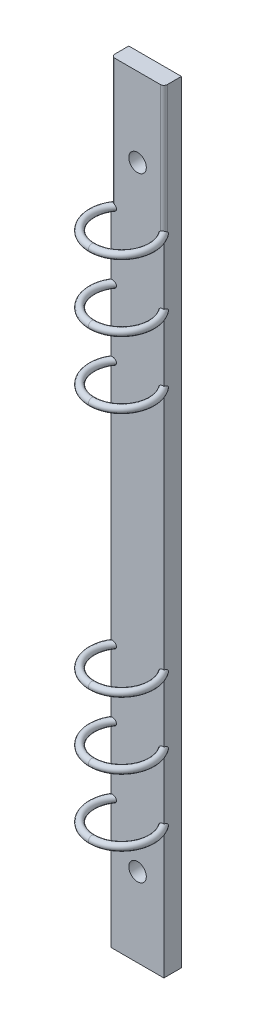
from build123d import *

# Parameters (mm, degrees)
SKETCH_1_W               = 15
SKETCH_1_H               = 220
SKETCH_1_R               = 2.5
EXTRUDE_1_DEPTH          = 5
SWEEP_2_PROFILE_R        = 1
PATTERN_LINEAR_4_COUNT   = 3
PATTERN_LINEAR_4_PITCH   = 19
MIRROR_1_COPY_1_SKETCH_R = 1
MIRROR_1_COPY_2_SKETCH_R = 1
FILLET_1_R               = 1


with BuildPart() as part:
    # Эскиз1 → Бобышка-Вытянуть1 (new body)
    with BuildSketch(Plane.XY):
        Rectangle(SKETCH_1_W, SKETCH_1_H)
        with Locations((0, 87.5)):
            Circle(SKETCH_1_R, mode=Mode.SUBTRACT)
        with Locations(Location((0, -87.5, 0), (0, 0, 180))):
            Circle(SKETCH_1_R, mode=Mode.SUBTRACT)
    extrude(amount=EXTRUDE_1_DEPTH)

    # По траектории2: sweep along a path in Эскиз28
    with BuildLine(Plane(origin=(0, 35, 0), x_dir=(1, 0, 0), z_dir=(0, 1, 0))) as sweep_2_path:
        CenterArc((0, -9.5), 8.5, 0, 360)
    # По траектории2 profile (on start of the path) → По траектории2 (sweep)
    with BuildSketch(Plane(origin=(8.5, 35, 9.5), x_dir=(-1, 0, 0), z_dir=(0, 0, -1))):
        Circle(SWEEP_2_PROFILE_R)
    sweep_2 = sweep(path=sweep_2_path.line)

    # Линейный массив4: По траектории2 ×3
    with Locations(*[(0, i * PATTERN_LINEAR_4_PITCH, 0) for i in range(1, PATTERN_LINEAR_4_COUNT)]):
        add(sweep_2)

    # Зеркальное отражение1: По траектории2 across plane
    add(sweep_2.mirror(Plane.ZX))

    # Зеркальное отражение1 copy 1: sweep along a path in Зеркальное отражение1 copy 1 path
    with BuildLine(Plane.XZ.offset(54)) as mirror_1_copy_1_path:
        CenterArc((0, 9.5), 8.5, 0, 360)
    # Зеркальное отражение1 copy 1 sketch → Зеркальное отражение1 copy 1 (sweep)
    with BuildSketch(Plane(origin=(8.5, -54, 9.5), x_dir=(-1, 0, 0), z_dir=(0, 0, -1))):
        Circle(MIRROR_1_COPY_1_SKETCH_R)
    sweep(path=mirror_1_copy_1_path.line)

    # Зеркальное отражение1 copy 2: sweep along a path in Зеркальное отражение1 copy 2 path
    with BuildLine(Plane.XZ.offset(73)) as mirror_1_copy_2_path:
        CenterArc((0, 9.5), 8.5, 0, 360)
    # Зеркальное отражение1 copy 2 sketch → Зеркальное отражение1 copy 2 (sweep)
    with BuildSketch(Plane(origin=(8.5, -73, 9.5), x_dir=(-1, 0, 0), z_dir=(0, 0, -1))):
        Circle(MIRROR_1_COPY_2_SKETCH_R)
    sweep(path=mirror_1_copy_2_path.line)

    # Скругление1
    fillet_1_edges = [part.edges().sort_by_distance(p)[0] for p in [
        (-7.5, 91.984580571, 5),
        (7.5, 91.984580571, 5),
    ]]
    fillet(fillet_1_edges, radius=FILLET_1_R)


solid = part.part
